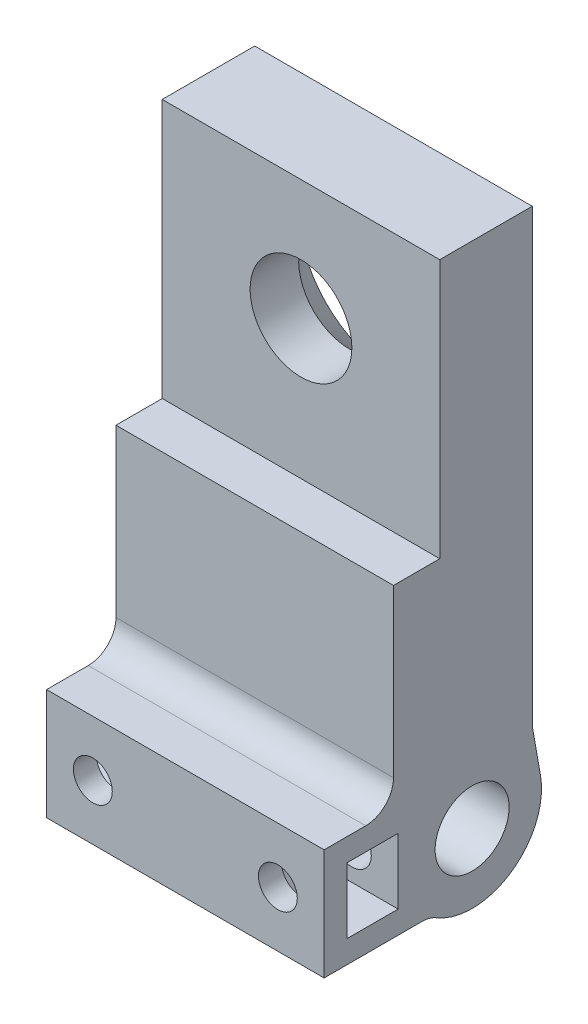
from build123d import *

# Parameters (mm, degrees)
SKETCH1_R                                           = 4
BOSS_EXTRUDE1_DEPTH                                 = 15
SKETCH2_W                                           = 11.5
SKETCH2_H                                           = 12
BOSS_EXTRUDE2_DEPTH                                 = 30
FILLET1_R                                           = 3
SKETCH3_R                                           = 2.1
CUT_EXTRUDE1_DEPTH                                  = 60.211485372
CUT_EXTRUDE2_REACH                                  = 63.662
CUT_EXTRUDE2_END_RADIUS                             = 4
SKETCH4_R                                           = 2.1
CUT_EXTRUDE3_START                                  = -2.5
CUT_EXTRUDE3_DEPTH                                  = 5.5
CUT_EXTRUDE4_DEPTH                                  = 62.288253385
CUT_EXTRUDE4_DEPTH_BACK                             = 5
SKETCH6_R                                           = 5
CSK_FOR_M10_HEX_SOCKET_COUNTERSUNK_HEAD_D           = 11
CSK_FOR_M10_HEX_SOCKET_COUNTERSUNK_HEAD_CSINK_D     = 20.5
CSK_FOR_M10_HEX_SOCKET_COUNTERSUNK_HEAD_CSINK_ANGLE = 90
SKETCH9_W                                           = 30
SKETCH9_H                                           = 28
CUT_EXTRUDE5_DEPTH                                  = 5


with BuildPart() as part:
    # Sketch1 → Boss-Extrude1 (new, symmetric)
    with BuildSketch(Plane(origin=(0, 0, 0), x_dir=(0, 0, -1), z_dir=(1, 0, 0))):
        with BuildLine():
            Line((6.5, 55), (6.5, 6.327446796))
            Line((6.5, 6.327446796), (7.386058148, 1.302361333))
            ThreePointArc((7.386058148, 1.302361333), (1.302361333, -7.386058148), (-7.386058148, -1.302361333))
            Line((-7.386058148, -1.302361333), (-8.5, 5.015116843))
            Line((-8.5, 5.015116843), (-8.5, 55))
            Line((-8.5, 55), (6.5, 55))
        make_face()
        Circle(SKETCH1_R, mode=Mode.SUBTRACT)
    extrude(amount=BOSS_EXTRUDE1_DEPTH, both=True)

    # Sketch2 → Boss-Extrude2 (add)
    with BuildSketch(Plane(origin=(15, 0, 0), x_dir=(0, 0, -1), z_dir=(1, 0, 0))):
        with Locations((-10.25, 0)):
            Rectangle(SKETCH2_W, SKETCH2_H)
    extrude(amount=-BOSS_EXTRUDE2_DEPTH)

    # Fillet1
    fillet1_edges = [part.edges().sort_by_distance(p)[0] for p in [
        (0, 6.327446796, -6.5),
        (0, 6, 8.5),
        (0, -6, 4.5),
    ]]
    fillet(fillet1_edges, radius=FILLET1_R)

    # Sketch3 → Cut-Extrude1 (cut, through all)
    with BuildSketch(Plane.XY.offset(8.5)):
        with Locations((0, 42)):
            Circle(SKETCH3_R)
    extrude(amount=-CUT_EXTRUDE1_DEPTH, mode=Mode.SUBTRACT)

    # Cut-Extrude2: up to this cylinder (the profile starts outside it)
    cut_extrude2_end = Plane(origin=(0, 0, 0), z_dir=(-1, 0, 0)) * Cylinder(CUT_EXTRUDE2_END_RADIUS, 156.324, mode=Mode.PRIVATE)
    # Sketch4 → Cut-Extrude2 (cut, up to the surface)
    with BuildSketch(Plane.XY.offset(16), mode=Mode.PRIVATE) as cut_extrude2_sk1:
        with Locations((-10, 0)):
            Circle(SKETCH4_R)
    cut_extrude2_tool1 = extrude(cut_extrude2_sk1.sketch, amount=-CUT_EXTRUDE2_REACH, mode=Mode.PRIVATE) - cut_extrude2_end
    add(cut_extrude2_tool1.solids().sort_by_distance((-10, 0, 16))[0], mode=Mode.SUBTRACT)
    # Sketch4 → Cut-Extrude2 (cut, up to the surface)
    with BuildSketch(Plane.XY.offset(16), mode=Mode.PRIVATE) as cut_extrude2_sk2:
        with Locations((10, 0)):
            Circle(SKETCH4_R)
    cut_extrude2_tool2 = extrude(cut_extrude2_sk2.sketch, amount=-CUT_EXTRUDE2_REACH, mode=Mode.PRIVATE) - cut_extrude2_end
    add(cut_extrude2_tool2.solids().sort_by_distance((10, 0, 16))[0], mode=Mode.SUBTRACT)

    # Sketch5 → Cut-Extrude3 (cut)
    with BuildSketch(Plane.XY.offset(16).offset(CUT_EXTRUDE3_START)):
        Polygon((-12.049593456, 3.55), (-15, 3.55), (-15, -3.55), (-12.049593456, -3.55), (-7.950406544, -3.55), (-5.900813089, 0), (-7.950406544, 3.55), align=None)
    cut_extrude3 = extrude(amount=-CUT_EXTRUDE3_DEPTH, mode=Mode.SUBTRACT)

    # Mirror1: Cut-Extrude3 across plane
    add(cut_extrude3.mirror(Plane(origin=(0, 0, 0), x_dir=(0, 0, 1), z_dir=(1, 0, 0))), mode=Mode.SUBTRACT)

    # Sketch6 → Cut-Extrude4 (cut, two sides: drawn at the far end of the back side and taken through both)
    with BuildSketch(Plane(origin=(0, 0, -6.5), x_dir=(-1, 0, 0), z_dir=(0, 0, -1)).offset(-CUT_EXTRUDE4_DEPTH_BACK)):
        with Locations(Location((-7, 18.75, 0), (0, 0, 90))):
            Circle(SKETCH6_R)
    extrude(amount=CUT_EXTRUDE4_DEPTH + CUT_EXTRUDE4_DEPTH_BACK, mode=Mode.SUBTRACT)

    # CSK for M10 Hex Socket Countersunk Head Screw1 (through all)
    with Locations(Plane(origin=(0, 0, -6.5), x_dir=(-1, 0, 0), z_dir=(0, 0, -1))):
        with Locations((0, 42)):
            CounterSinkHole(CSK_FOR_M10_HEX_SOCKET_COUNTERSUNK_HEAD_D / 2, CSK_FOR_M10_HEX_SOCKET_COUNTERSUNK_HEAD_CSINK_D / 2, counter_sink_angle=CSK_FOR_M10_HEX_SOCKET_COUNTERSUNK_HEAD_CSINK_ANGLE)

    # Sketch9 → Cut-Extrude5 (cut)
    with BuildSketch(Plane.XY.offset(8.5)):
        with Locations((0, 41)):
            Rectangle(SKETCH9_W, SKETCH9_H)
    extrude(amount=-CUT_EXTRUDE5_DEPTH, mode=Mode.SUBTRACT)


solid = part.part
